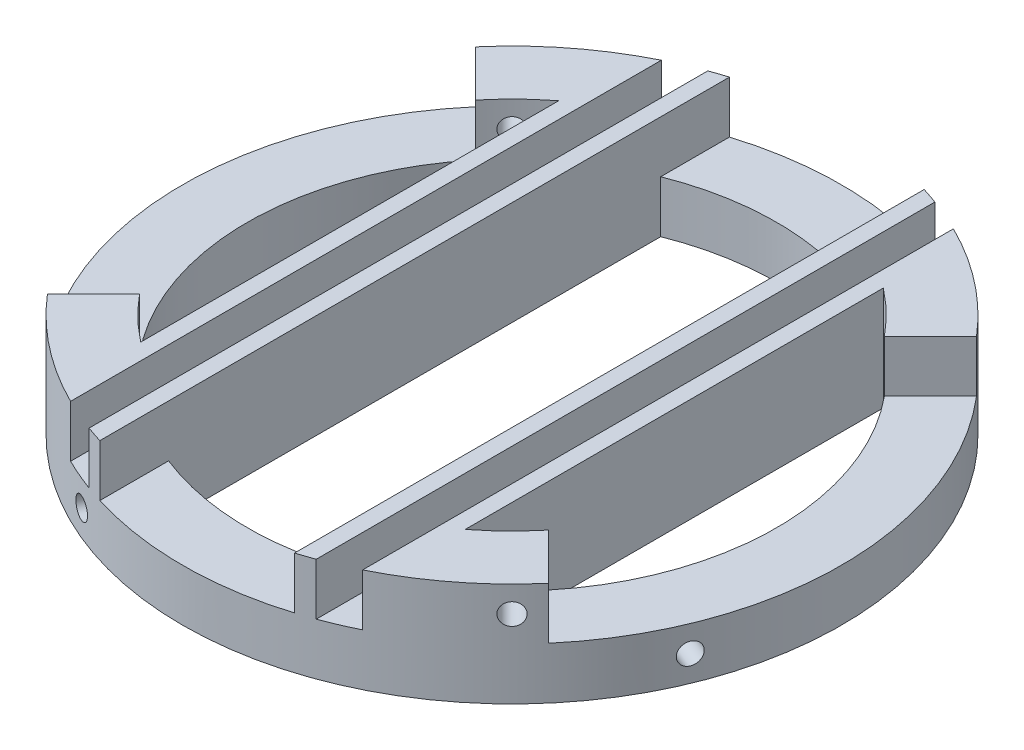
from build123d import *
from build123d.topology import SkipClean

# Parameters (mm, degrees)
SKETCH1_R                       = 50.7746
BOSS_EXTRUDE1_DEPTH             = 4
BOSS_EXTRUDE2_START             = 8
BOSS_EXTRUDE2_DEPTH             = 8
M4_TAPPED_HOLE1_D               = 3.3
M4_TAPPED_HOLE1_DEPTH           = 10.1
M4_TAPPED_HOLE1_TIP             = 0.991420021
M4_TAPPED_HOLE1_ON_FACE_2_D     = 3.3
M4_TAPPED_HOLE1_ON_FACE_2_DEPTH = 10.1
M4_TAPPED_HOLE1_ON_FACE_2_TIP   = 0.991420021
M4_TAPPED_HOLE1_ON_FACE_3_D     = 3.3
M4_TAPPED_HOLE1_ON_FACE_3_DEPTH = 10.1
M4_TAPPED_HOLE1_ON_FACE_3_TIP   = 0.991420021
M4_TAPPED_HOLE1_ON_FACE_4_D     = 3.3
M4_TAPPED_HOLE1_ON_FACE_4_DEPTH = 10.1
M4_TAPPED_HOLE1_ON_FACE_4_TIP   = 0.991420021
M4_TAPPED_HOLE1_ON_FACE_5_D     = 3.3
M4_TAPPED_HOLE1_ON_FACE_5_DEPTH = 10.1
M4_TAPPED_HOLE1_ON_FACE_5_TIP   = 0.991420021
M4_TAPPED_HOLE1_ON_FACE_6_D     = 3.3
M4_TAPPED_HOLE1_ON_FACE_6_DEPTH = 10.1
M4_TAPPED_HOLE1_ON_FACE_6_TIP   = 0.991420021
M4_TAPPED_HOLE1_ON_FACE_7_D     = 3.3
M4_TAPPED_HOLE1_ON_FACE_7_DEPTH = 10.1
M4_TAPPED_HOLE1_ON_FACE_7_TIP   = 0.991420021
M4_TAPPED_HOLE1_ON_FACE_8_D     = 3.3
M4_TAPPED_HOLE1_ON_FACE_8_DEPTH = 10.1
M4_TAPPED_HOLE1_ON_FACE_8_TIP   = 0.991420021


with BuildPart() as part:
    # Sketch1 → Boss-Extrude1 (new, symmetric)
    with BuildSketch(Plane(origin=(0, 0, 0), x_dir=(1, 0, 0), z_dir=(0, 1, 0))):
        with Locations(Location((0, 0, 0), (0, 0, 270))):
            Circle(SKETCH1_R)
        with BuildLine():
            ThreePointArc((15, 37.915274035), (0, 40.7746), (-15, 37.915274035))
            Line((-15, 37.915274035), (-15, -37.915274035))
            ThreePointArc((-15, -37.915274035), (0, -40.7746), (15, -37.915274035))
            Line((15, -37.915274035), (15, 37.915274035))
        make_face(mode=Mode.SUBTRACT)
        with BuildLine():
            ThreePointArc((25, -32.211302444), (40.7746, 0), (25, 32.211302444))
            Line((25, 32.211302444), (25, -32.211302444))
        make_face(mode=Mode.SUBTRACT)
        with BuildLine():
            ThreePointArc((-25, 32.211302444), (-40.7746, 0), (-25, -32.211302444))
            Line((-25, -32.211302444), (-25, 32.211302444))
        make_face(mode=Mode.SUBTRACT)
    extrude(amount=BOSS_EXTRUDE1_DEPTH, both=True)

    # Sketch2 → Boss-Extrude2 (add)
    with SkipClean():  # the faces are left unmerged after this step: merging them gives an invalid solid
        with BuildSketch(Plane(origin=(0, 4, 0), x_dir=(1, 0, 0), z_dir=(0, 1, 0)).offset(BOSS_EXTRUDE2_START)):
            with BuildLine():
                Line((-22.5, -45.517139686), (-22.5, 45.517139686))
                ThreePointArc((-22.5, 45.517139686), (-31.197949015, 40.059305815), (-38.619906594, 32.963052344))
                Line((-38.619906594, 32.963052344), (-31.521353127, 25.864498878))
                ThreePointArc((-31.521353127, 25.864498878), (-28.438289659, 29.220398465), (-25, 32.211302444))
                Line((-25, 32.211302444), (-25, -32.211302444))
                ThreePointArc((-25, -32.211302444), (-28.438289659, -29.220398465), (-31.521353127, -25.864498878))
                Line((-31.521353127, -25.864498878), (-38.619906594, -32.963052344))
                ThreePointArc((-38.619906594, -32.963052344), (-31.197949015, -40.059305815), (-22.5, -45.517139686))
            make_face()
            with BuildLine():
                ThreePointArc((-15, 48.50834985), (-16.255489516, 48.102173192), (-17.5, 47.663508108))
                Line((-17.5, 47.663508108), (-17.5, -47.663508108))
                ThreePointArc((-17.5, -47.663508108), (-16.255489516, -48.102173192), (-15, -48.50834985))
                Line((-15, -48.50834985), (-15, 48.50834985))
            make_face()
            with BuildLine():
                ThreePointArc((17.5, 47.663508108), (16.255489516, 48.102173192), (15, 48.50834985))
                Line((15, 48.50834985), (15, -48.50834985))
                ThreePointArc((15, -48.50834985), (16.255489516, -48.102173192), (17.5, -47.663508108))
                Line((17.5, -47.663508108), (17.5, 47.663508108))
            make_face()
            with BuildLine():
                ThreePointArc((38.619906594, 32.963052344), (31.197949015, 40.059305815), (22.5, 45.517139686))
                Line((22.5, 45.517139686), (22.5, -45.517139686))
                ThreePointArc((22.5, -45.517139686), (31.197949015, -40.059305815), (38.619906594, -32.963052344))
                Line((38.619906594, -32.963052344), (31.521353127, -25.864498878))
                ThreePointArc((31.521353127, -25.864498878), (28.438289659, -29.220398465), (25, -32.211302444))
                Line((25, -32.211302444), (25, 32.211302444))
                ThreePointArc((25, 32.211302444), (28.438289659, 29.220398465), (31.521353127, 25.864498878))
                Line((31.521353127, 25.864498878), (38.619906594, 32.963052344))
            make_face()
        extrude(amount=-BOSS_EXTRUDE2_DEPTH)

    # M4 Tapped Hole1
    with Locations(Plane(origin=(-19.430598205, 0, 46.909613711), x_dir=(0.923879532511, 0, 0.382683432365), z_dir=(-0.382683432365, 0, 0.923879532511))):
        with Locations((0, 0)):
            Hole(M4_TAPPED_HOLE1_D / 2, depth=M4_TAPPED_HOLE1_DEPTH)
            with Locations((0, 0, -(M4_TAPPED_HOLE1_DEPTH + M4_TAPPED_HOLE1_TIP / 2))):  # 118° drill point
                Cone(0, M4_TAPPED_HOLE1_D / 2, M4_TAPPED_HOLE1_TIP, mode=Mode.SUBTRACT)

    # M4 Tapped Hole1 on face 2
    with Locations(Plane(origin=(46.909613711, 0, 19.430598205), x_dir=(-0.382682898036, 0, 0.923879753837), z_dir=(0.923879753837, 0, 0.382682898036))):
        with Locations((0, 0)):
            Hole(M4_TAPPED_HOLE1_ON_FACE_2_D / 2, depth=M4_TAPPED_HOLE1_ON_FACE_2_DEPTH)
            with Locations((0, 0, -(M4_TAPPED_HOLE1_ON_FACE_2_DEPTH + M4_TAPPED_HOLE1_ON_FACE_2_TIP / 2))):  # 118° drill point
                Cone(0, M4_TAPPED_HOLE1_ON_FACE_2_D / 2, M4_TAPPED_HOLE1_ON_FACE_2_TIP, mode=Mode.SUBTRACT)

    # M4 Tapped Hole1 on face 3
    with Locations(Plane(origin=(-35.903063972, 0, -35.903063972), x_dir=(-0.707106781187, 0, 0.707106781187), z_dir=(-0.707106781187, 0, -0.707106781187))):
        with Locations((0, 0), (0, 8)):
            Hole(M4_TAPPED_HOLE1_ON_FACE_3_D / 2, depth=M4_TAPPED_HOLE1_ON_FACE_3_DEPTH)
            with Locations((0, 0, -(M4_TAPPED_HOLE1_ON_FACE_3_DEPTH + M4_TAPPED_HOLE1_ON_FACE_3_TIP / 2))):  # 118° drill point
                Cone(0, M4_TAPPED_HOLE1_ON_FACE_3_D / 2, M4_TAPPED_HOLE1_ON_FACE_3_TIP, mode=Mode.SUBTRACT)

    # M4 Tapped Hole1 on face 4
    with Locations(Plane(origin=(19.430598205, 0, -46.909613711), x_dir=(-0.923879753837, 0, -0.382682898036), z_dir=(0.382682898036, 0, -0.923879753837))):
        with Locations((0, 0)):
            Hole(M4_TAPPED_HOLE1_ON_FACE_4_D / 2, depth=M4_TAPPED_HOLE1_ON_FACE_4_DEPTH)
            with Locations((0, 0, -(M4_TAPPED_HOLE1_ON_FACE_4_DEPTH + M4_TAPPED_HOLE1_ON_FACE_4_TIP / 2))):  # 118° drill point
                Cone(0, M4_TAPPED_HOLE1_ON_FACE_4_D / 2, M4_TAPPED_HOLE1_ON_FACE_4_TIP, mode=Mode.SUBTRACT)

    # M4 Tapped Hole1 on face 5
    with Locations(Plane(origin=(0, 8, 0), x_dir=(0.923879532511, 0, 0.382683432365), z_dir=(-0.382683432365, 0, 0.923879532511))):
        with Locations((0, 0)):
            Hole(M4_TAPPED_HOLE1_ON_FACE_5_D / 2, depth=M4_TAPPED_HOLE1_ON_FACE_5_DEPTH)
            with Locations((0, 0, -(M4_TAPPED_HOLE1_ON_FACE_5_DEPTH + M4_TAPPED_HOLE1_ON_FACE_5_TIP / 2))):  # 118° drill point
                Cone(0, M4_TAPPED_HOLE1_ON_FACE_5_D / 2, M4_TAPPED_HOLE1_ON_FACE_5_TIP, mode=Mode.SUBTRACT)

    # M4 Tapped Hole1 on face 6
    with Locations(Plane(origin=(35.903063972, 8, 35.903063972), x_dir=(0.707106781187, 0, -0.707106781187), z_dir=(0.707106781187, 0, 0.707106781187))):
        with Locations((0, 0)):
            Hole(M4_TAPPED_HOLE1_ON_FACE_6_D / 2, depth=M4_TAPPED_HOLE1_ON_FACE_6_DEPTH)
            with Locations((0, 0, -(M4_TAPPED_HOLE1_ON_FACE_6_DEPTH + M4_TAPPED_HOLE1_ON_FACE_6_TIP / 2))):  # 118° drill point
                Cone(0, M4_TAPPED_HOLE1_ON_FACE_6_D / 2, M4_TAPPED_HOLE1_ON_FACE_6_TIP, mode=Mode.SUBTRACT)

    # M4 Tapped Hole1 on face 7
    with Locations(Plane(origin=(35.903063972, 8, -35.903063972), x_dir=(-0.707106781187, 0, -0.707106781187), z_dir=(0.707106781187, 0, -0.707106781187))):
        with Locations((0, 0)):
            Hole(M4_TAPPED_HOLE1_ON_FACE_7_D / 2, depth=M4_TAPPED_HOLE1_ON_FACE_7_DEPTH)
            with Locations((0, 0, -(M4_TAPPED_HOLE1_ON_FACE_7_DEPTH + M4_TAPPED_HOLE1_ON_FACE_7_TIP / 2))):  # 118° drill point
                Cone(0, M4_TAPPED_HOLE1_ON_FACE_7_D / 2, M4_TAPPED_HOLE1_ON_FACE_7_TIP, mode=Mode.SUBTRACT)

    # M4 Tapped Hole1 on face 8
    with Locations(Plane(origin=(-35.903063972, 8, 35.903063972), x_dir=(0.707106781187, 0, 0.707106781187), z_dir=(-0.707106781187, 0, 0.707106781187))):
        with Locations((0, 0)):
            Hole(M4_TAPPED_HOLE1_ON_FACE_8_D / 2, depth=M4_TAPPED_HOLE1_ON_FACE_8_DEPTH)
            with Locations((0, 0, -(M4_TAPPED_HOLE1_ON_FACE_8_DEPTH + M4_TAPPED_HOLE1_ON_FACE_8_TIP / 2))):  # 118° drill point
                Cone(0, M4_TAPPED_HOLE1_ON_FACE_8_D / 2, M4_TAPPED_HOLE1_ON_FACE_8_TIP, mode=Mode.SUBTRACT)


solid = part.part
